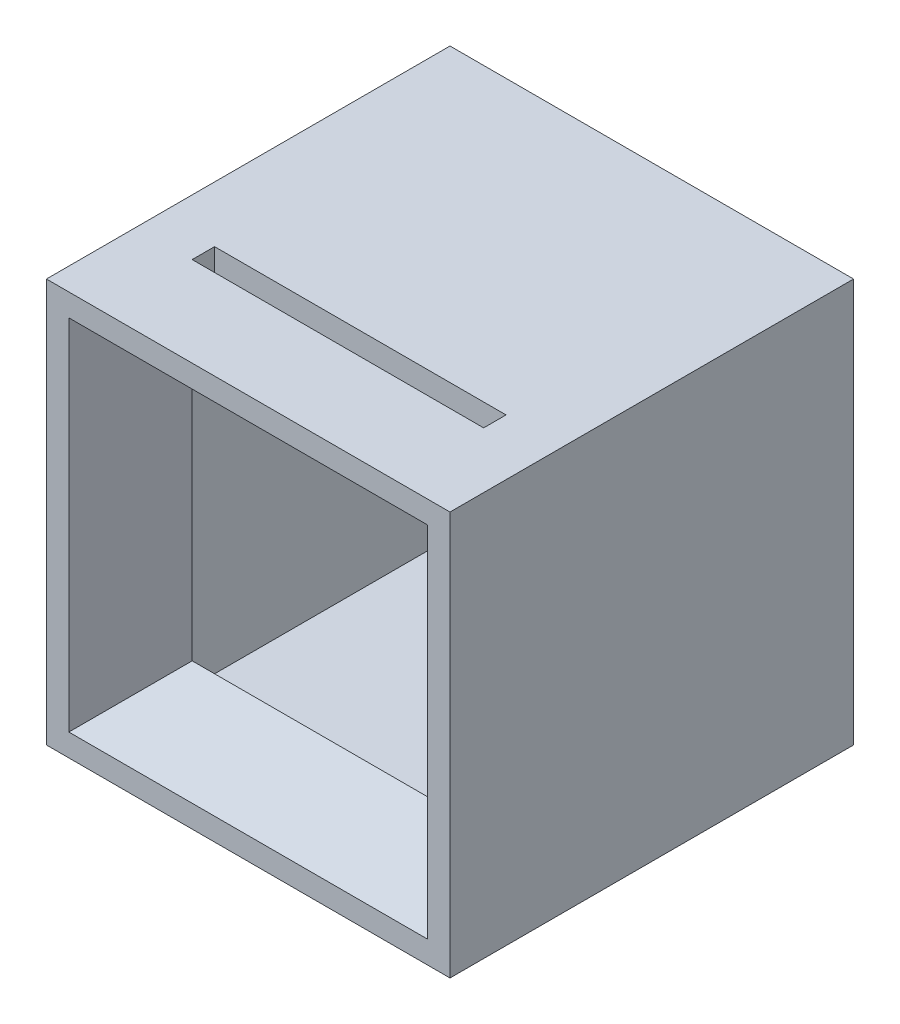
from build123d import *

# Parameters (mm, degrees)
SKETCH1_W               = 457.2
SKETCH1_H               = 457.2
BOSS_EXTRUDE1_DEPTH     = 457.2
SKETCH4_W               = 330.2
SKETCH4_H               = 330.2
CUT_EXTRUDE1_DEPTH      = 457.2
SKETCH5_W               = 330.2
SKETCH5_H               = 355.6
CUT_EXTRUDE2_DEPTH      = 25.4
CUT_EXTRUDE3_DEPTH      = 792.893629278
CUT_EXTRUDE3_DEPTH_BACK = 792.893629278
SKETCH7_W               = 330.2
SKETCH7_H               = 25.4


with BuildPart() as part:
    # Sketch1 → Boss-Extrude1 (new body)
    with BuildSketch(Plane.XY):
        with Locations((228.6, 228.6)):
            Rectangle(SKETCH1_W, SKETCH1_H)
    extrude(amount=BOSS_EXTRUDE1_DEPTH)

    # Sketch2 → Cut-Loft1 section 0
    with BuildSketch(Plane.XY.offset(457.2)):
        with BuildLine():
            Line((25.4, 25.4), (431.8, 25.4))
            Line((431.8, 25.4), (431.8, 431.8))
            Line((431.8, 431.8), (25.4, 431.8))
            Line((25.4, 431.8), (25.4, 25.4))
        make_face()
    # Sketch3 → Cut-Loft1 section 1
    with BuildSketch(Plane.XY.offset(355.6)):
        with BuildLine():
            Line((63.5, 63.5), (393.7, 63.5))
            Line((393.7, 63.5), (393.7, 393.7))
            Line((393.7, 393.7), (63.5, 393.7))
            Line((63.5, 393.7), (63.5, 63.5))
        make_face()
    loft(mode=Mode.SUBTRACT)

    # Sketch4 → Cut-Extrude1 (cut)
    with BuildSketch(Plane.XY.offset(355.6)):
        with Locations((228.6, 228.6)):
            Rectangle(SKETCH4_W, SKETCH4_H)
    extrude(amount=-CUT_EXTRUDE1_DEPTH, mode=Mode.SUBTRACT)

    # Sketch5 → Cut-Extrude2 (cut)
    with BuildSketch(Plane(origin=(0, 63.5, 0), x_dir=(1, 0, 0), z_dir=(0, 1, 0))):
        with Locations((228.6, -177.8)):
            Rectangle(SKETCH5_W, SKETCH5_H)
    extrude(amount=-CUT_EXTRUDE2_DEPTH, mode=Mode.SUBTRACT)

    # Sketch7 → Cut-Extrude3 (cut, two sides: drawn at the far end of the back side and taken through both)
    with BuildSketch(Plane(origin=(0, 457.2, 0), x_dir=(1, 0, 0), z_dir=(0, 1, 0)).offset(-CUT_EXTRUDE3_DEPTH_BACK)):
        with Locations((228.6, -342.9)):
            Rectangle(SKETCH7_W, SKETCH7_H)
    extrude(amount=CUT_EXTRUDE3_DEPTH + CUT_EXTRUDE3_DEPTH_BACK, mode=Mode.SUBTRACT)


solid = part.part
